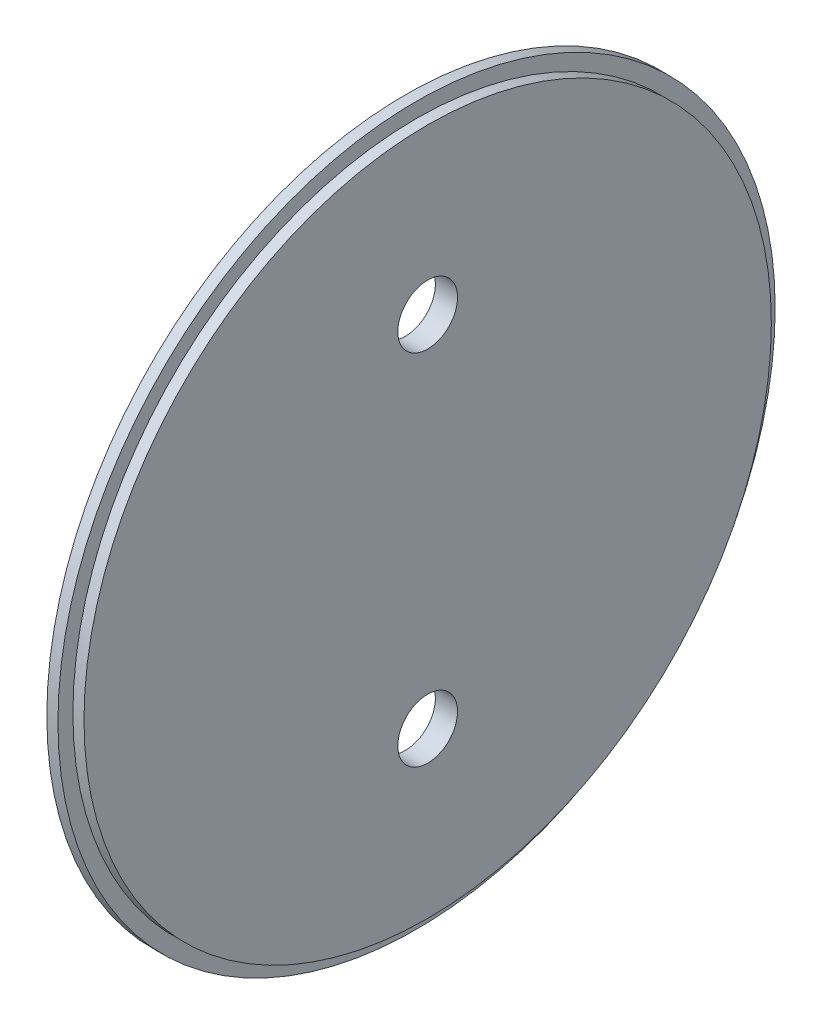
from build123d import *

# Parameters (mm, degrees)
SKETCH1_R           = 38.1
BOSS_EXTRUDE1_DEPTH = 1.1811
SKETCH2_R           = 36.5125
BOSS_EXTRUDE2_DEPTH = 1.1811
SKETCH3_R           = 3.175
CUT_EXTRUDE1_DEPTH  = 54.933292027


with BuildPart() as part:
    # Sketch1 → Boss-Extrude1 (new body)
    with BuildSketch(Plane.YZ):
        with Locations(Location((0, 0, 0), (0, 0, 270))):
            Circle(SKETCH1_R)
    extrude(amount=BOSS_EXTRUDE1_DEPTH)

    # Sketch2 → Boss-Extrude2 (add)
    with BuildSketch(Plane.YZ.offset(1.1811)):
        with Locations(Location((0, 0, 0), (0, 0, 270))):
            Circle(SKETCH2_R)
    extrude(amount=BOSS_EXTRUDE2_DEPTH)

    # Sketch3 → Cut-Extrude1 (cut, through all)
    with BuildSketch(Plane(origin=(0, 0, 0), x_dir=(0, -1, 0), z_dir=(-1, 0, 0))):
        with Locations(Location((19.05, 0, 0), (0, 0, 90))):
            Circle(SKETCH3_R)
        with Locations(Location((-19.05, 0, 0), (0, 0, 90))):
            Circle(SKETCH3_R)
    extrude(amount=-CUT_EXTRUDE1_DEPTH, mode=Mode.SUBTRACT)


solid = part.part
